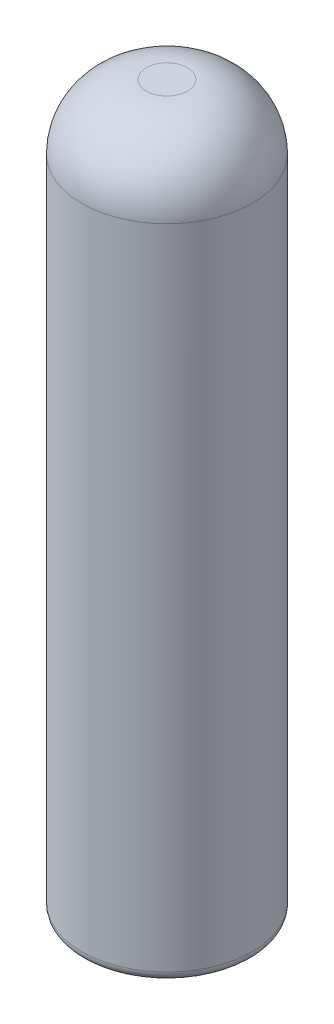
from build123d import *

# Parameters (mm, degrees)
FILLET1_R = 10


with BuildPart() as part:
    # Sketch1 → Revolve1 (revolve)
    with BuildSketch(Plane.XY, mode=Mode.PRIVATE) as revolve1_sk:
        with BuildLine():
            Line((0, 0), (-85.5, 0))
            Line((-85.5, 0), (-85.5, 660))
            ThreePointArc((-85.5, 660), (-66.461940777, 705.961940777), (-20.5, 725))
            Line((-20.5, 725), (0, 725))
            Line((0, 725), (0, 0))
        make_face()
    revolve(revolve1_sk.sketch.rotate(Axis((0, 0, 0), (0, -1, 0)), 270), axis=Axis((0, 0, 0), (0, -1, 0)))

    # Fillet1
    fillet1_edges = [part.edges().sort_by_distance(p)[0] for p in [
        (0, 0, -85.5),
    ]]
    fillet(fillet1_edges, radius=FILLET1_R)


solid = part.part
